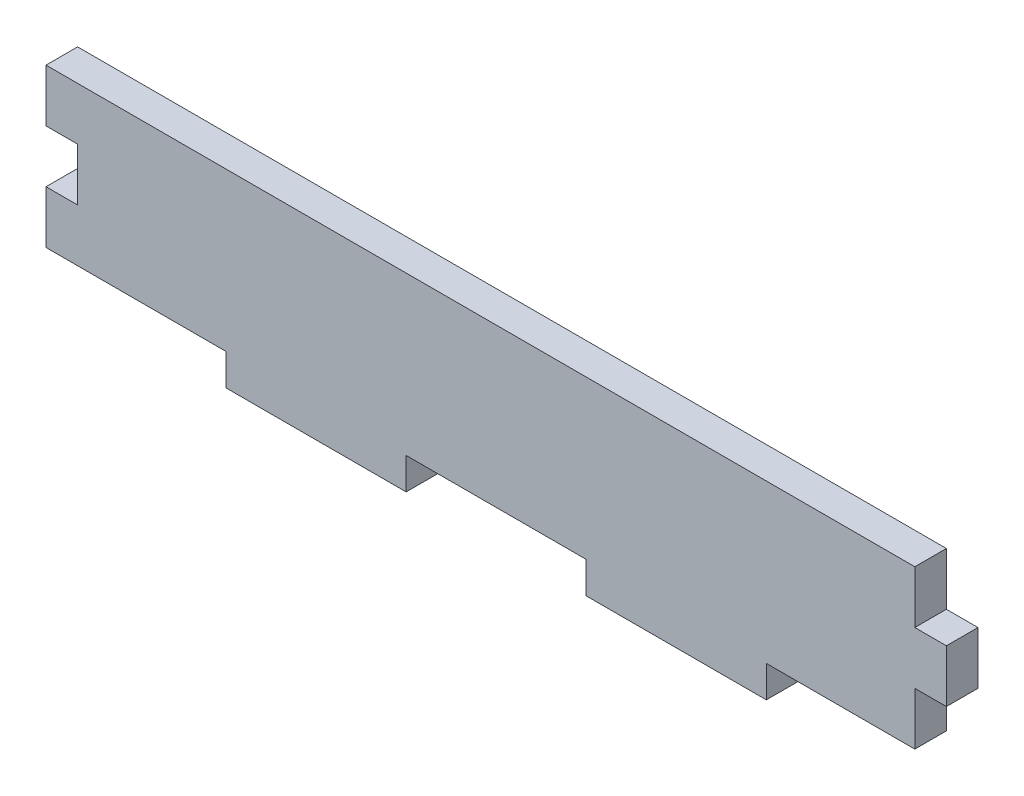
from build123d import *

# Parameters (mm, degrees)
SKETCH1_W           = 144.78
SKETCH1_H           = 30.48
BOSS_EXTRUDE1_DEPTH = 5.08
SKETCH2_W           = 28.956
SKETCH2_H           = 5.08
CUT_EXTRUDE1_DEPTH  = 149.040822748
SKETCH3_W           = 5.08
SKETCH3_H           = 8.466666666
SKETCH3_H_2         = 8.466666667
CUT_EXTRUDE2_DEPTH  = 149.040822748


with BuildPart() as part:
    # Sketch1 → Boss-Extrude1 (new body)
    with BuildSketch(Plane.XY):
        with Locations((72.39, 15.24)):
            Rectangle(SKETCH1_W, SKETCH1_H)
    extrude(amount=BOSS_EXTRUDE1_DEPTH)

    # Sketch2 → Cut-Extrude1 (cut, through all)
    with BuildSketch(Plane.XY.offset(5.08)):
        with Locations((14.478, 2.54)):
            Rectangle(SKETCH2_W, SKETCH2_H)
        with Locations((72.39, 2.54)):
            Rectangle(SKETCH2_W, SKETCH2_H)
        with Locations((130.302, 2.54)):
            Rectangle(SKETCH2_W, SKETCH2_H)
    extrude(amount=-CUT_EXTRUDE1_DEPTH, mode=Mode.SUBTRACT)

    # Sketch3 → Cut-Extrude2 (cut, through all)
    with BuildSketch(Plane.XY.offset(5.08)):
        with Locations((2.54, 17.78)):
            Rectangle(SKETCH3_W, SKETCH3_H)
        with Locations((142.24, 26.246666667)):
            Rectangle(SKETCH3_W, SKETCH3_H_2)
        with Locations((142.24, 9.313333334)):
            Rectangle(SKETCH3_W, SKETCH3_H_2)
    extrude(amount=-CUT_EXTRUDE2_DEPTH, mode=Mode.SUBTRACT)


solid = part.part
